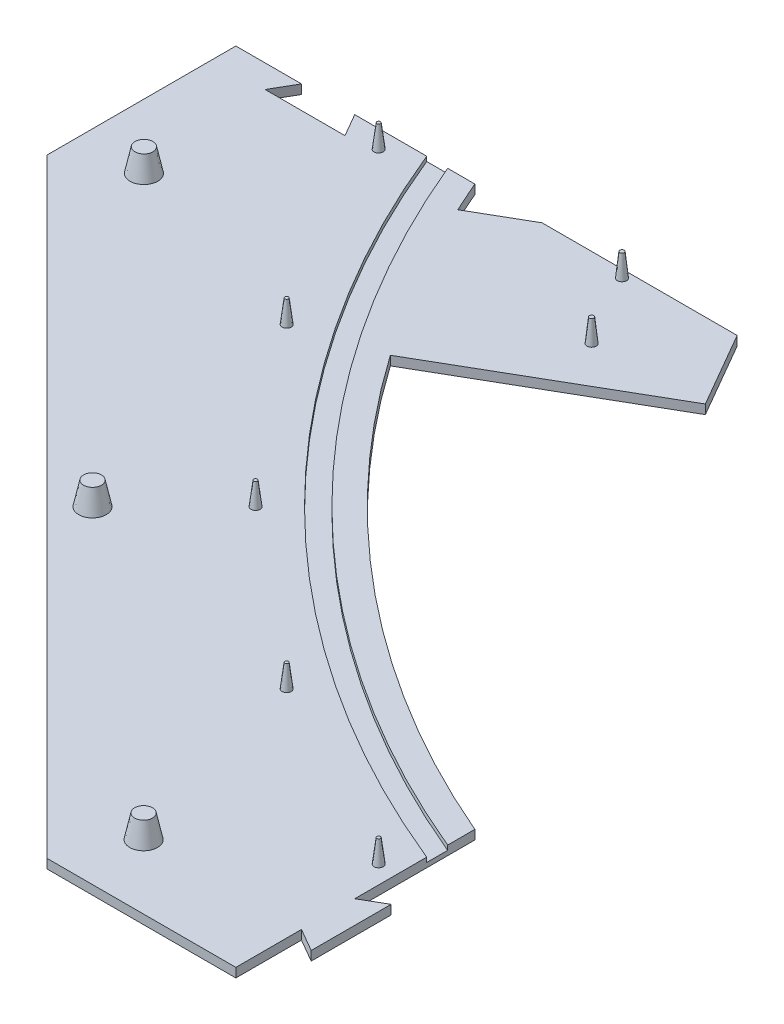
from build123d import *

# Parameters (mm, degrees)
BASEPLATE_PROFILE_DEPTH               = 2
SKETCH2_R                             = 1
M3_PINS_DEPTH                         = 5
M3_PINS_TAPER                         = 7
CIRPATTERN1_COUNT                     = 32
SKETCH4_R                             = 1
PILLAR_PINS_DEPTH                     = 5
PILLAR_PINS_DRAFT                     = 6
PILLAR_PINS_PROFILE_2_DEPTH           = 5
PILLAR_PINS_PROFILE_2_DRAFT           = 6
CIRPATTERN2_COPY_1_SKETCH_R           = 1
CIRPATTERN2_COPY_1_DEPTH              = 5
CIRPATTERN2_COPY_1_DRAFT              = 6
CIRPATTERN2_COPY_2_SKETCH_R           = 1
CIRPATTERN2_COPY_2_DEPTH              = 5
CIRPATTERN2_COPY_2_DRAFT              = 6
CIRPATTERN2_COPY_3_SKETCH_R           = 1
CIRPATTERN2_COPY_3_DEPTH              = 5
CIRPATTERN2_COPY_3_DRAFT              = 6
CIRPATTERN2_COPY_4_SKETCH_R           = 1
CIRPATTERN2_COPY_4_DEPTH              = 5
CIRPATTERN2_COPY_4_DRAFT              = 6
CIRPATTERN2_COPY_5_SKETCH_R           = 1
CIRPATTERN2_COPY_5_DEPTH              = 5
CIRPATTERN2_COPY_5_DRAFT              = 6
CIRPATTERN2_COPY_6_SKETCH_R           = 1
CIRPATTERN2_COPY_6_DEPTH              = 5
CIRPATTERN2_COPY_6_DRAFT              = 6
CIRPATTERN2_COPY_7_SKETCH_R           = 1
CIRPATTERN2_COPY_7_DEPTH              = 5
CIRPATTERN2_COPY_7_DRAFT              = 6
CIRPATTERN2_COPY_8_SKETCH_R           = 1
CIRPATTERN2_COPY_8_DEPTH              = 5
CIRPATTERN2_COPY_8_DRAFT              = 6
CIRPATTERN2_COPY_9_SKETCH_R           = 1
CIRPATTERN2_COPY_9_DEPTH              = 5
CIRPATTERN2_COPY_9_DRAFT              = 6
CIRPATTERN2_COPY_10_SKETCH_R          = 1
CIRPATTERN2_COPY_10_DEPTH             = 5
CIRPATTERN2_COPY_10_DRAFT             = 6
CIRPATTERN2_COPY_11_SKETCH_R          = 1
CIRPATTERN2_COPY_11_DEPTH             = 5
CIRPATTERN2_COPY_11_DRAFT             = 6
CIRPATTERN2_COPY_12_SKETCH_R          = 1
CIRPATTERN2_COPY_12_DEPTH             = 5
CIRPATTERN2_COPY_12_DRAFT             = 6
CIRPATTERN2_COPY_13_SKETCH_R          = 1
CIRPATTERN2_COPY_13_DEPTH             = 5
CIRPATTERN2_COPY_13_DRAFT             = 6
CIRPATTERN2_COPY_14_SKETCH_R          = 1
CIRPATTERN2_COPY_14_DEPTH             = 5
CIRPATTERN2_COPY_14_DRAFT             = 6
CIRPATTERN2_COPY_15_SKETCH_R          = 1
CIRPATTERN2_COPY_15_DEPTH             = 5
CIRPATTERN2_COPY_15_DRAFT             = 6
SKETCH5_R                             = 3
M8_HOLE_1_DEPTH                       = 5
M8_HOLE_1_TAPER                       = 12
M8_1_PATTERN_COUNT                    = 4
SKETCH6_R                             = 3
EXTRUDE_M8_2_DEPTH                    = 5
EXTRUDE_M8_2_TAPER                    = 12
M8_2_PATTERN_COUNT                    = 4
PATTERN_CIRCULAR_M8_3_COUNT           = 2
PATTERN_CIRCULAR_M8_3_ANGLE           = 36.9
PATTERN_CIRCULAR_M8_3_COPY_1_SKETCH_R = 3
PATTERN_CIRCULAR_M8_3_COPY_1_DEPTH    = 5
PATTERN_CIRCULAR_M8_3_COPY_1_TAPER    = 12
PATTERN_CIRCULAR_M8_3_COPY_2_SKETCH_R = 3
PATTERN_CIRCULAR_M8_3_COPY_2_DEPTH    = 5
PATTERN_CIRCULAR_M8_3_COPY_2_TAPER    = 12
PATTERN_CIRCULAR_M8_3_COPY_3_SKETCH_R = 3
PATTERN_CIRCULAR_M8_3_COPY_3_DEPTH    = 5
PATTERN_CIRCULAR_M8_3_COPY_3_TAPER    = 12
CUT_CENTER_DEPTH                      = 374.385859402
CIRPATTERN7_COUNT                     = 6
SKETCH13_W                            = 601.338043825
SKETCH13_H                            = 775.691829322
SKETCH13_W_2                          = 173
SKETCH13_H_2                          = 173
CUT_EXTRUDE2_DEPTH                    = 10
BOSS_EXTRUDE1_DEPTH                   = 2
CUT_EXTRUDE3_DEPTH                    = 374.385859402
SKETCH16_R                            = 240.5
SKETCH16_R_2                          = 236.3
CUT_EXTRUDE4_DEPTH                    = 1


with BuildPart() as part:
    # Sketch1 → baseplate profile (new body)
    with BuildSketch(Plane(origin=(0, 0, 0), x_dir=(1, 0, 0), z_dir=(0, 1, 0))):
        Polygon((264, 0), (264, 131.98), (131.979594929, 264), (0, 264), (-131.98, 264), (-264, 131.979594929), (-264, 0), (-264, -131.98), (-131.979594929, -264), (0, -264), (131.98, -264), (264, -131.979594929), align=None)
    extrude(amount=-BASEPLATE_PROFILE_DEPTH)

    # Sketch2 → M3 pins (add)
    with BuildSketch(Plane(origin=(0, 0, 0), x_dir=(1, 0, 0), z_dir=(0, 1, 0))):
        with Locations((0, 248)):
            Circle(SKETCH2_R)
    m3_pins = extrude(amount=M3_PINS_DEPTH, taper=M3_PINS_TAPER)

    # CirPattern1: M3 pins ×32 about axis
    cirpattern1_axis = Axis((0, 0, 0), (0, 1, 0))
    for i in range(1, CIRPATTERN1_COUNT):
        add(m3_pins.rotate(cirpattern1_axis, i * 360 / CIRPATTERN1_COUNT))


with BuildPart() as pillar_pins_tool:
    # Sketch4 → pillar pins (with draft: the straight prism first)
    with BuildSketch(Plane(origin=(0, 0, 0), x_dir=(1, 0, 0), z_dir=(0, 1, 0))):
        with Locations((9, 201)):
            Circle(SKETCH4_R)
    extrude(amount=PILLAR_PINS_DEPTH)
    # pillar pins: the draft: its side faces are tilted about the plane it starts from
    pillar_pins_sides = [pillar_pins_tool.faces().sort_by_distance(p)[0] for p in [
        (8, 2.5, -201),
    ]]
    draft(pillar_pins_sides, Plane(origin=(0, 0, 0), x_dir=(1, 0, 0), z_dir=(0, 1, 0)), PILLAR_PINS_DRAFT)


with BuildPart() as part_1:
    add(part.part)

    # pillar pins: add pillar_pins_tool
    add(pillar_pins_tool.part)


with BuildPart() as pillar_pins_profile_2_tool:
    # Sketch4 → pillar pins profile 2 (with draft: the straight prism first)
    with BuildSketch(Plane(origin=(0, 0, 0), x_dir=(1, 0, 0), z_dir=(0, 1, 0))):
        with Locations((-9, 201)):
            Circle(SKETCH4_R)
    extrude(amount=PILLAR_PINS_PROFILE_2_DEPTH)
    # pillar pins profile 2: the draft: its side faces are tilted about the plane it starts from
    pillar_pins_profile_2_sides = [pillar_pins_profile_2_tool.faces().sort_by_distance(p)[0] for p in [
        (-10, 2.5, -201),
    ]]
    draft(pillar_pins_profile_2_sides, Plane(origin=(0, 0, 0), x_dir=(1, 0, 0), z_dir=(0, 1, 0)), PILLAR_PINS_PROFILE_2_DRAFT)


with BuildPart() as part_2:
    add(part_1.part)

    # pillar pins profile 2: add pillar_pins_profile_2_tool
    add(pillar_pins_profile_2_tool.part)


with BuildPart() as cirpattern2_copy_1_tool:
    # CirPattern2 copy 1 sketch → CirPattern2 copy 1 (with draft: the straight prism first)
    with BuildSketch(Plane(origin=(0, 0, 0), x_dir=(0.5000000000000001, 0, -0.8660254037844386), z_dir=(0, 1, 0))):
        with Locations((9, 201)):
            Circle(CIRPATTERN2_COPY_1_SKETCH_R)
    extrude(amount=CIRPATTERN2_COPY_1_DEPTH)
    # CirPattern2 copy 1: the draft: its side faces are tilted about the plane it starts from
    cirpattern2_copy_1_sides = [cirpattern2_copy_1_tool.faces().sort_by_distance(p)[0] for p in [
        (-170.071106161, 2.5, -107.42820323),
    ]]
    draft(cirpattern2_copy_1_sides, Plane(origin=(0, 0, 0), x_dir=(0.5000000000000001, 0, -0.8660254037844386), z_dir=(0, 1, 0)), CIRPATTERN2_COPY_1_DRAFT)


with BuildPart() as part_3:
    add(part_2.part)

    # CirPattern2 copy 1: add cirpattern2_copy_1_tool
    add(cirpattern2_copy_1_tool.part)


with BuildPart() as cirpattern2_copy_2_tool:
    # CirPattern2 copy 2 sketch → CirPattern2 copy 2 (with draft: the straight prism first)
    with BuildSketch(Plane(origin=(0, 0, 0), x_dir=(-0.4999999999999998, 0, -0.8660254037844387), z_dir=(0, 1, 0))):
        with Locations((9, 201)):
            Circle(CIRPATTERN2_COPY_2_SKETCH_R)
    extrude(amount=CIRPATTERN2_COPY_2_DEPTH)
    # CirPattern2 copy 2: the draft: its side faces are tilted about the plane it starts from
    cirpattern2_copy_2_sides = [cirpattern2_copy_2_tool.faces().sort_by_distance(p)[0] for p in [
        (-178.071106161, 2.5, 93.57179677),
    ]]
    draft(cirpattern2_copy_2_sides, Plane(origin=(0, 0, 0), x_dir=(-0.4999999999999998, 0, -0.8660254037844387), z_dir=(0, 1, 0)), CIRPATTERN2_COPY_2_DRAFT)


with BuildPart() as part_4:
    add(part_3.part)

    # CirPattern2 copy 2: add cirpattern2_copy_2_tool
    add(cirpattern2_copy_2_tool.part)


with BuildPart() as cirpattern2_copy_3_tool:
    # CirPattern2 copy 3 sketch → CirPattern2 copy 3 (with draft: the straight prism first)
    with BuildSketch(Plane(origin=(0, 0, 0), x_dir=(-1, 0, 0), z_dir=(0, 1, 0))):
        with Locations((9, 201)):
            Circle(CIRPATTERN2_COPY_3_SKETCH_R)
    extrude(amount=CIRPATTERN2_COPY_3_DEPTH)
    # CirPattern2 copy 3: the draft: its side faces are tilted about the plane it starts from
    cirpattern2_copy_3_sides = [cirpattern2_copy_3_tool.faces().sort_by_distance(p)[0] for p in [
        (-8, 2.5, 201),
    ]]
    draft(cirpattern2_copy_3_sides, Plane(origin=(0, 0, 0), x_dir=(-1, 0, 0), z_dir=(0, 1, 0)), CIRPATTERN2_COPY_3_DRAFT)


with BuildPart() as part_5:
    add(part_4.part)

    # CirPattern2 copy 3: add cirpattern2_copy_3_tool
    add(cirpattern2_copy_3_tool.part)


with BuildPart() as cirpattern2_copy_4_tool:
    # CirPattern2 copy 4 sketch → CirPattern2 copy 4 (with draft: the straight prism first)
    with BuildSketch(Plane(origin=(0, 0, 0), x_dir=(-0.5000000000000004, 0, 0.8660254037844384), z_dir=(0, 1, 0))):
        with Locations((9, 201)):
            Circle(CIRPATTERN2_COPY_4_SKETCH_R)
    extrude(amount=CIRPATTERN2_COPY_4_DEPTH)
    # CirPattern2 copy 4: the draft: its side faces are tilted about the plane it starts from
    cirpattern2_copy_4_sides = [cirpattern2_copy_4_tool.faces().sort_by_distance(p)[0] for p in [
        (170.071106161, 2.5, 107.42820323),
    ]]
    draft(cirpattern2_copy_4_sides, Plane(origin=(0, 0, 0), x_dir=(-0.5000000000000004, 0, 0.8660254037844384), z_dir=(0, 1, 0)), CIRPATTERN2_COPY_4_DRAFT)


with BuildPart() as part_6:
    add(part_5.part)

    # CirPattern2 copy 4: add cirpattern2_copy_4_tool
    add(cirpattern2_copy_4_tool.part)


with BuildPart() as cirpattern2_copy_5_tool:
    # CirPattern2 copy 5 sketch → CirPattern2 copy 5 (with draft: the straight prism first)
    with BuildSketch(Plane(origin=(0, 0, 0), x_dir=(0.5000000000000001, 0, 0.8660254037844386), z_dir=(0, 1, 0))):
        with Locations((9, 201)):
            Circle(CIRPATTERN2_COPY_5_SKETCH_R)
    extrude(amount=CIRPATTERN2_COPY_5_DEPTH)
    # CirPattern2 copy 5: the draft: its side faces are tilted about the plane it starts from
    cirpattern2_copy_5_sides = [cirpattern2_copy_5_tool.faces().sort_by_distance(p)[0] for p in [
        (178.071106161, 2.5, -93.57179677),
    ]]
    draft(cirpattern2_copy_5_sides, Plane(origin=(0, 0, 0), x_dir=(0.5000000000000001, 0, 0.8660254037844386), z_dir=(0, 1, 0)), CIRPATTERN2_COPY_5_DRAFT)


with BuildPart() as part_7:
    add(part_6.part)

    # CirPattern2 copy 5: add cirpattern2_copy_5_tool
    add(cirpattern2_copy_5_tool.part)


with BuildPart() as cirpattern2_copy_6_tool:
    # CirPattern2 copy 6 sketch → CirPattern2 copy 6 (with draft: the straight prism first)
    with BuildSketch(Plane(origin=(0, 0, 0), x_dir=(0.5000000000000001, 0, -0.8660254037844386), z_dir=(0, 1, 0))):
        with Locations((-9, 201)):
            Circle(CIRPATTERN2_COPY_6_SKETCH_R)
    extrude(amount=CIRPATTERN2_COPY_6_DEPTH)
    # CirPattern2 copy 6: the draft: its side faces are tilted about the plane it starts from
    cirpattern2_copy_6_sides = [cirpattern2_copy_6_tool.faces().sort_by_distance(p)[0] for p in [
        (-179.071106161, 2.5, -91.839745962),
    ]]
    draft(cirpattern2_copy_6_sides, Plane(origin=(0, 0, 0), x_dir=(0.5000000000000001, 0, -0.8660254037844386), z_dir=(0, 1, 0)), CIRPATTERN2_COPY_6_DRAFT)


with BuildPart() as part_8:
    add(part_7.part)

    # CirPattern2 copy 6: add cirpattern2_copy_6_tool
    add(cirpattern2_copy_6_tool.part)


with BuildPart() as cirpattern2_copy_7_tool:
    # CirPattern2 copy 7 sketch → CirPattern2 copy 7 (with draft: the straight prism first)
    with BuildSketch(Plane(origin=(0, 0, 0), x_dir=(-0.4999999999999998, 0, -0.8660254037844387), z_dir=(0, 1, 0))):
        with Locations((-9, 201)):
            Circle(CIRPATTERN2_COPY_7_SKETCH_R)
    extrude(amount=CIRPATTERN2_COPY_7_DEPTH)
    # CirPattern2 copy 7: the draft: its side faces are tilted about the plane it starts from
    cirpattern2_copy_7_sides = [cirpattern2_copy_7_tool.faces().sort_by_distance(p)[0] for p in [
        (-169.071106161, 2.5, 109.160254038),
    ]]
    draft(cirpattern2_copy_7_sides, Plane(origin=(0, 0, 0), x_dir=(-0.4999999999999998, 0, -0.8660254037844387), z_dir=(0, 1, 0)), CIRPATTERN2_COPY_7_DRAFT)


with BuildPart() as part_9:
    add(part_8.part)

    # CirPattern2 copy 7: add cirpattern2_copy_7_tool
    add(cirpattern2_copy_7_tool.part)


with BuildPart() as cirpattern2_copy_8_tool:
    # CirPattern2 copy 8 sketch → CirPattern2 copy 8 (with draft: the straight prism first)
    with BuildSketch(Plane(origin=(0, 0, 0), x_dir=(-1, 0, 0), z_dir=(0, 1, 0))):
        with Locations((-9, 201)):
            Circle(CIRPATTERN2_COPY_8_SKETCH_R)
    extrude(amount=CIRPATTERN2_COPY_8_DEPTH)
    # CirPattern2 copy 8: the draft: its side faces are tilted about the plane it starts from
    cirpattern2_copy_8_sides = [cirpattern2_copy_8_tool.faces().sort_by_distance(p)[0] for p in [
        (10, 2.5, 201),
    ]]
    draft(cirpattern2_copy_8_sides, Plane(origin=(0, 0, 0), x_dir=(-1, 0, 0), z_dir=(0, 1, 0)), CIRPATTERN2_COPY_8_DRAFT)


with BuildPart() as part_10:
    add(part_9.part)

    # CirPattern2 copy 8: add cirpattern2_copy_8_tool
    add(cirpattern2_copy_8_tool.part)


with BuildPart() as cirpattern2_copy_9_tool:
    # CirPattern2 copy 9 sketch → CirPattern2 copy 9 (with draft: the straight prism first)
    with BuildSketch(Plane(origin=(0, 0, 0), x_dir=(-0.5000000000000004, 0, 0.8660254037844384), z_dir=(0, 1, 0))):
        with Locations((-9, 201)):
            Circle(CIRPATTERN2_COPY_9_SKETCH_R)
    extrude(amount=CIRPATTERN2_COPY_9_DEPTH)
    # CirPattern2 copy 9: the draft: its side faces are tilted about the plane it starts from
    cirpattern2_copy_9_sides = [cirpattern2_copy_9_tool.faces().sort_by_distance(p)[0] for p in [
        (179.071106161, 2.5, 91.839745962),
    ]]
    draft(cirpattern2_copy_9_sides, Plane(origin=(0, 0, 0), x_dir=(-0.5000000000000004, 0, 0.8660254037844384), z_dir=(0, 1, 0)), CIRPATTERN2_COPY_9_DRAFT)


with BuildPart() as part_11:
    add(part_10.part)

    # CirPattern2 copy 9: add cirpattern2_copy_9_tool
    add(cirpattern2_copy_9_tool.part)


with BuildPart() as cirpattern2_copy_10_tool:
    # CirPattern2 copy 10 sketch → CirPattern2 copy 10 (with draft: the straight prism first)
    with BuildSketch(Plane(origin=(0, 0, 0), x_dir=(0.5000000000000001, 0, 0.8660254037844386), z_dir=(0, 1, 0))):
        with Locations((-9, 201)):
            Circle(CIRPATTERN2_COPY_10_SKETCH_R)
    extrude(amount=CIRPATTERN2_COPY_10_DEPTH)
    # CirPattern2 copy 10: the draft: its side faces are tilted about the plane it starts from
    cirpattern2_copy_10_sides = [cirpattern2_copy_10_tool.faces().sort_by_distance(p)[0] for p in [
        (169.071106161, 2.5, -109.160254038),
    ]]
    draft(cirpattern2_copy_10_sides, Plane(origin=(0, 0, 0), x_dir=(0.5000000000000001, 0, 0.8660254037844386), z_dir=(0, 1, 0)), CIRPATTERN2_COPY_10_DRAFT)


with BuildPart() as part_12:
    add(part_11.part)

    # CirPattern2 copy 10: add cirpattern2_copy_10_tool
    add(cirpattern2_copy_10_tool.part)


with BuildPart() as cirpattern2_copy_11_tool:
    # CirPattern2 copy 11 sketch → CirPattern2 copy 11 (with draft: the straight prism first)
    with BuildSketch(Plane(origin=(0, 0, 0), x_dir=(0.5000000000000001, 0, -0.8660254037844386), z_dir=(0, 1, 0))):
        with Locations((-9, 201)):
            Circle(CIRPATTERN2_COPY_11_SKETCH_R)
    extrude(amount=CIRPATTERN2_COPY_11_DEPTH)
    # CirPattern2 copy 11: the draft: its side faces are tilted about the plane it starts from
    cirpattern2_copy_11_sides = [cirpattern2_copy_11_tool.faces().sort_by_distance(p)[0] for p in [
        (-179.071106161, 2.5, -91.839745962),
    ]]
    draft(cirpattern2_copy_11_sides, Plane(origin=(0, 0, 0), x_dir=(0.5000000000000001, 0, -0.8660254037844386), z_dir=(0, 1, 0)), CIRPATTERN2_COPY_11_DRAFT)


with BuildPart() as part_13:
    add(part_12.part)

    # CirPattern2 copy 11: add cirpattern2_copy_11_tool
    add(cirpattern2_copy_11_tool.part)


with BuildPart() as cirpattern2_copy_12_tool:
    # CirPattern2 copy 12 sketch → CirPattern2 copy 12 (with draft: the straight prism first)
    with BuildSketch(Plane(origin=(0, 0, 0), x_dir=(-0.4999999999999998, 0, -0.8660254037844387), z_dir=(0, 1, 0))):
        with Locations((-9, 201)):
            Circle(CIRPATTERN2_COPY_12_SKETCH_R)
    extrude(amount=CIRPATTERN2_COPY_12_DEPTH)
    # CirPattern2 copy 12: the draft: its side faces are tilted about the plane it starts from
    cirpattern2_copy_12_sides = [cirpattern2_copy_12_tool.faces().sort_by_distance(p)[0] for p in [
        (-169.071106161, 2.5, 109.160254038),
    ]]
    draft(cirpattern2_copy_12_sides, Plane(origin=(0, 0, 0), x_dir=(-0.4999999999999998, 0, -0.8660254037844387), z_dir=(0, 1, 0)), CIRPATTERN2_COPY_12_DRAFT)


with BuildPart() as part_14:
    add(part_13.part)

    # CirPattern2 copy 12: add cirpattern2_copy_12_tool
    add(cirpattern2_copy_12_tool.part)


with BuildPart() as cirpattern2_copy_13_tool:
    # CirPattern2 copy 13 sketch → CirPattern2 copy 13 (with draft: the straight prism first)
    with BuildSketch(Plane(origin=(0, 0, 0), x_dir=(-1, 0, 0), z_dir=(0, 1, 0))):
        with Locations((-9, 201)):
            Circle(CIRPATTERN2_COPY_13_SKETCH_R)
    extrude(amount=CIRPATTERN2_COPY_13_DEPTH)
    # CirPattern2 copy 13: the draft: its side faces are tilted about the plane it starts from
    cirpattern2_copy_13_sides = [cirpattern2_copy_13_tool.faces().sort_by_distance(p)[0] for p in [
        (10, 2.5, 201),
    ]]
    draft(cirpattern2_copy_13_sides, Plane(origin=(0, 0, 0), x_dir=(-1, 0, 0), z_dir=(0, 1, 0)), CIRPATTERN2_COPY_13_DRAFT)


with BuildPart() as part_15:
    add(part_14.part)

    # CirPattern2 copy 13: add cirpattern2_copy_13_tool
    add(cirpattern2_copy_13_tool.part)


with BuildPart() as cirpattern2_copy_14_tool:
    # CirPattern2 copy 14 sketch → CirPattern2 copy 14 (with draft: the straight prism first)
    with BuildSketch(Plane(origin=(0, 0, 0), x_dir=(-0.5000000000000004, 0, 0.8660254037844384), z_dir=(0, 1, 0))):
        with Locations((-9, 201)):
            Circle(CIRPATTERN2_COPY_14_SKETCH_R)
    extrude(amount=CIRPATTERN2_COPY_14_DEPTH)
    # CirPattern2 copy 14: the draft: its side faces are tilted about the plane it starts from
    cirpattern2_copy_14_sides = [cirpattern2_copy_14_tool.faces().sort_by_distance(p)[0] for p in [
        (179.071106161, 2.5, 91.839745962),
    ]]
    draft(cirpattern2_copy_14_sides, Plane(origin=(0, 0, 0), x_dir=(-0.5000000000000004, 0, 0.8660254037844384), z_dir=(0, 1, 0)), CIRPATTERN2_COPY_14_DRAFT)


with BuildPart() as part_16:
    add(part_15.part)

    # CirPattern2 copy 14: add cirpattern2_copy_14_tool
    add(cirpattern2_copy_14_tool.part)


with BuildPart() as cirpattern2_copy_15_tool:
    # CirPattern2 copy 15 sketch → CirPattern2 copy 15 (with draft: the straight prism first)
    with BuildSketch(Plane(origin=(0, 0, 0), x_dir=(0.5000000000000001, 0, 0.8660254037844386), z_dir=(0, 1, 0))):
        with Locations((-9, 201)):
            Circle(CIRPATTERN2_COPY_15_SKETCH_R)
    extrude(amount=CIRPATTERN2_COPY_15_DEPTH)
    # CirPattern2 copy 15: the draft: its side faces are tilted about the plane it starts from
    cirpattern2_copy_15_sides = [cirpattern2_copy_15_tool.faces().sort_by_distance(p)[0] for p in [
        (169.071106161, 2.5, -109.160254038),
    ]]
    draft(cirpattern2_copy_15_sides, Plane(origin=(0, 0, 0), x_dir=(0.5000000000000001, 0, 0.8660254037844386), z_dir=(0, 1, 0)), CIRPATTERN2_COPY_15_DRAFT)


with BuildPart() as part_17:
    add(part_16.part)

    # CirPattern2 copy 15: add cirpattern2_copy_15_tool
    add(cirpattern2_copy_15_tool.part)

    # Sketch5 → M8 hole -1 (add)
    with BuildSketch(Plane(origin=(0, 0, 0), x_dir=(1, 0, 0), z_dir=(0, 1, 0))):
        with Locations((-193.040151264, 193.040151264)):
            Circle(SKETCH5_R)
    m8_hole_1 = extrude(amount=M8_HOLE_1_DEPTH, taper=M8_HOLE_1_TAPER)

    # M8 -1 pattern: M8 hole -1 ×4 about axis
    m8_1_pattern_axis = Axis((0, 0, 0), (0, 1, 0))
    for i in range(1, M8_1_PATTERN_COUNT):
        add(m8_hole_1.rotate(m8_1_pattern_axis, i * 360 / M8_1_PATTERN_COUNT))

    # Sketch6 → M8 -2 (add)
    with BuildSketch(Plane(origin=(0, 0, 0), x_dir=(1, 0, 0), z_dir=(0, 1, 0))):
        with Locations((-125, -250)):
            Circle(SKETCH6_R)
    extrude_m8_2 = extrude(amount=EXTRUDE_M8_2_DEPTH, taper=EXTRUDE_M8_2_TAPER)

    # M8 -2 pattern: M8 -2 ×4 about axis
    m8_2_pattern_axis = Axis((0, 0, 0), (0, 1, 0))
    for i in range(1, M8_2_PATTERN_COUNT):
        add(extrude_m8_2.rotate(m8_2_pattern_axis, i * 360 / M8_2_PATTERN_COUNT))

    # M8 -3: M8 -2 ×2 about axis
    pattern_circular_m8_3_axis = Axis((0, 0, 0), (0, -1, 0))
    for i in range(1, PATTERN_CIRCULAR_M8_3_COUNT):
        add(extrude_m8_2.rotate(pattern_circular_m8_3_axis, i * PATTERN_CIRCULAR_M8_3_ANGLE / (PATTERN_CIRCULAR_M8_3_COUNT - 1)))

    # M8 -3 copy 1 sketch → M8 -3 copy 1 (add)
    with BuildSketch(Plane(origin=(0, 0, 0), x_dir=(0.6004202253258852, 0, -0.7996846584870897), z_dir=(0, 1, 0))):
        with Locations((-125, -250)):
            Circle(PATTERN_CIRCULAR_M8_3_COPY_1_SKETCH_R)
    extrude(amount=PATTERN_CIRCULAR_M8_3_COPY_1_DEPTH, taper=PATTERN_CIRCULAR_M8_3_COPY_1_TAPER)

    # M8 -3 copy 2 sketch → M8 -3 copy 2 (add)
    with BuildSketch(Plane(origin=(0, 0, 0), x_dir=(-0.7996846584870896, 0, -0.6004202253258853), z_dir=(0, 1, 0))):
        with Locations((-125, -250)):
            Circle(PATTERN_CIRCULAR_M8_3_COPY_2_SKETCH_R)
    extrude(amount=PATTERN_CIRCULAR_M8_3_COPY_2_DEPTH, taper=PATTERN_CIRCULAR_M8_3_COPY_2_TAPER)

    # M8 -3 copy 3 sketch → M8 -3 copy 3 (add)
    with BuildSketch(Plane(origin=(0, 0, 0), x_dir=(-0.6004202253258853, 0, 0.7996846584870896), z_dir=(0, 1, 0))):
        with Locations((-125, -250)):
            Circle(PATTERN_CIRCULAR_M8_3_COPY_3_SKETCH_R)
    extrude(amount=PATTERN_CIRCULAR_M8_3_COPY_3_DEPTH, taper=PATTERN_CIRCULAR_M8_3_COPY_3_TAPER)

    # Sketch8 → cut center (cut, through all)
    with BuildSketch(Plane(origin=(0, 0, 0), x_dir=(1, 0, 0), z_dir=(0, 1, 0))):
        with BuildLine():
            Line((115.433963806, -199.937490231), (0, 0))
            Line((0, 0), (0, -180))
            Line((0, -180), (20, -180))
            Line((20, -180), (20, -230))
            ThreePointArc((20, -230), (69.365180469, -220.200980331), (115.433963806, -199.937490231))
        make_face()
        with BuildLine():
            Line((0, -180), (0, 0))
            Line((0, 0), (-115.433963806, -199.937490231))
            ThreePointArc((-115.433963806, -199.937490231), (-69.365180469, -220.200980331), (-20, -230))
            Line((-20, -230), (-20, -180))
            Line((-20, -180), (0, -180))
        make_face()
    cut_center = extrude(amount=-CUT_CENTER_DEPTH, mode=Mode.SUBTRACT)

    # CirPattern7: cut center ×6 about axis
    cirpattern7_axis = Axis((0, 0, 0), (0, 1, 0))
    for i in range(1, CIRPATTERN7_COUNT):
        add(cut_center.rotate(cirpattern7_axis, i * 360 / CIRPATTERN7_COUNT), mode=Mode.SUBTRACT)

    # Sketch13 → Cut-Extrude2 (cut)
    with BuildSketch(Plane.XZ.offset(2)):
        with Locations((-4.823567196, -26.230581065)):
            Rectangle(SKETCH13_W, SKETCH13_H)
        with Locations((-177.5, 177.5)):
            Rectangle(SKETCH13_W_2, SKETCH13_H_2, mode=Mode.SUBTRACT)
    extrude(amount=-CUT_EXTRUDE2_DEPTH, mode=Mode.SUBTRACT)

    # Sketch14 → Boss-Extrude1 (add)
    with BuildSketch(Plane(origin=(0, 0, 0), x_dir=(1, 0, 0), z_dir=(0, 1, 0))):
        Polygon((-101, -244), (-86, -252.660254038), (-86, -235.339745962), align=None)
    extrude(amount=-BOSS_EXTRUDE1_DEPTH)

    # Sketch15 → Cut-Extrude3 (cut, through all)
    with BuildSketch(Plane(origin=(0, 0, 0), x_dir=(1, 0, 0), z_dir=(0, 1, 0))):
        Polygon((-252.660254038, -96), (-235.339745962, -96), (-244, -81), align=None)
    extrude(amount=-CUT_EXTRUDE3_DEPTH, mode=Mode.SUBTRACT)

    # Sketch16 → Cut-Extrude4 (cut)
    with BuildSketch(Plane(origin=(0, 0, 0), x_dir=(1, 0, 0), z_dir=(0, 1, 0))):
        Circle(SKETCH16_R)
        Circle(SKETCH16_R_2, mode=Mode.SUBTRACT)
    extrude(amount=-CUT_EXTRUDE4_DEPTH, mode=Mode.SUBTRACT)


solid = part_17.part
